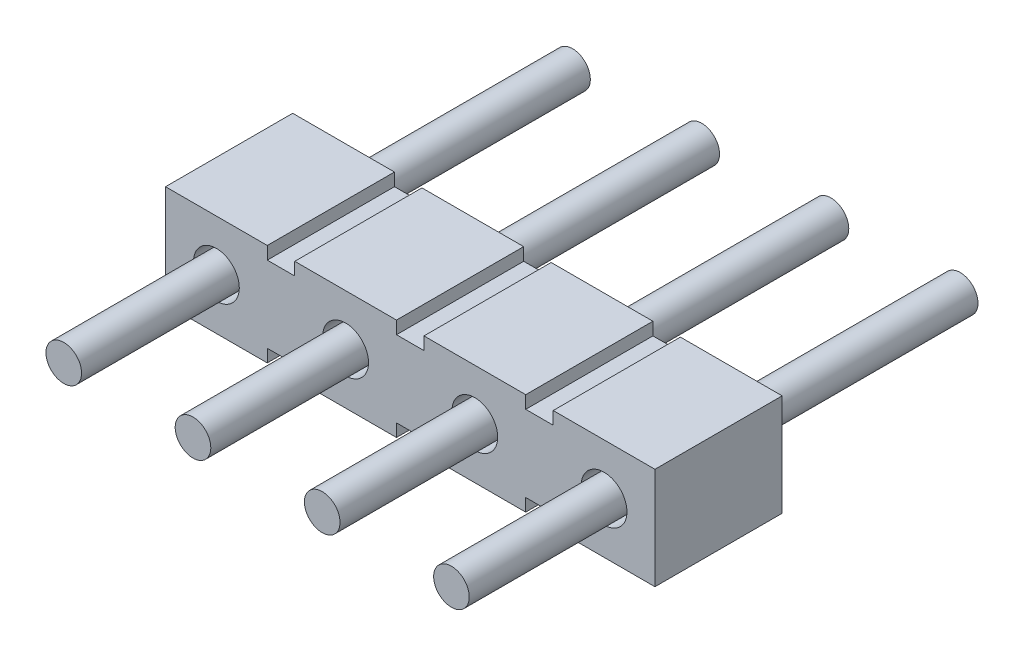
from build123d import *

# Parameters (mm, degrees)
IZIM1_R                       = 0.35
Y_KSEKLIK_EKSTR_ZYON1_DEPTH   = 10
Y_KSEKLIK_EKSTR_ZYON1_2_DEPTH = 10
Y_KSEKLIK_EKSTR_ZYON1_3_DEPTH = 10
Y_KSEKLIK_EKSTR_ZYON1_4_DEPTH = 10
IZIM3_R                       = 0.45
Y_KSEKLIK_EKSTR_ZYON2_DEPTH   = 2.5


with BuildPart() as part:
    # Çizim1 → Yükseklik-Ekstrüzyon1 (new body)
    with BuildSketch(Plane.XY):
        Circle(IZIM1_R)
    extrude(amount=Y_KSEKLIK_EKSTR_ZYON1_DEPTH)


with BuildPart() as body_2:
    # Çizim1 → Y_kseklik-Ekstr_zyon1 2 (new body)
    with BuildSketch(Plane.XY):
        with Locations((2.54, 0)):
            Circle(IZIM1_R)
    extrude(amount=Y_KSEKLIK_EKSTR_ZYON1_2_DEPTH)


with BuildPart() as body_3:
    # Çizim1 → Y_kseklik-Ekstr_zyon1 3 (new body)
    with BuildSketch(Plane.XY):
        with Locations((5.08, 0)):
            Circle(IZIM1_R)
    extrude(amount=Y_KSEKLIK_EKSTR_ZYON1_3_DEPTH)


with BuildPart() as body_4:
    # Çizim1 → Y_kseklik-Ekstr_zyon1 4 (new body)
    with BuildSketch(Plane.XY):
        with Locations((7.62, 0)):
            Circle(IZIM1_R)
    extrude(amount=Y_KSEKLIK_EKSTR_ZYON1_4_DEPTH)


with BuildPart() as body_5:
    # Çizim3 → Yükseklik-Ekstrüzyon2 (new body)
    with BuildSketch(Plane.XY.offset(7)):
        Polygon((1.54, 1), (3.54, 1), (3.54, 0.75), (4.08, 0.75), (4.08, 1), (6.08, 1), (6.08, 0.75), (6.62, 0.75), (6.62, 1), (8.62, 1), (8.62, -1), (6.62, -1), (6.62, -0.75), (6.08, -0.75), (6.08, -1), (4.08, -1), (4.08, -0.75), (3.54, -0.75), (3.54, -1), (1.54, -1), (1.54, -0.75), (1, -0.75), (1, -1), (-1, -1), (-1, 1), (1, 1), (1, 0.75), (1.54, 0.75), align=None)
        Circle(IZIM3_R, mode=Mode.SUBTRACT)
        with Locations((2.54, 0)):
            Circle(IZIM3_R, mode=Mode.SUBTRACT)
        with Locations((5.08, 0)):
            Circle(IZIM3_R, mode=Mode.SUBTRACT)
        with Locations((7.62, 0)):
            Circle(IZIM3_R, mode=Mode.SUBTRACT)
    extrude(amount=-Y_KSEKLIK_EKSTR_ZYON2_DEPTH)


solid = Compound([part.part, body_2.part, body_3.part, body_4.part, body_5.part])
